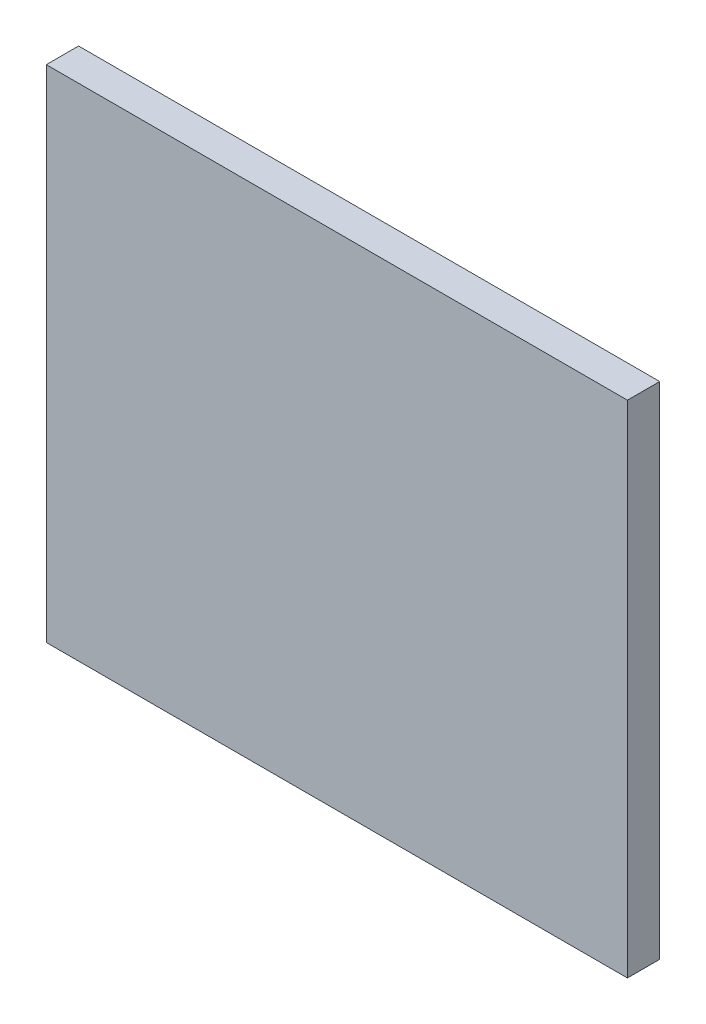
from build123d import *

# Parameters (mm, degrees)
SKETCH1_W     = 36
SKETCH1_H     = 31
PROFILE_DEPTH = 2


with BuildPart() as part:
    # Sketch1 → Profile (new body)
    with BuildSketch(Plane.XY):
        with Locations((18, 15.5)):
            Rectangle(SKETCH1_W, SKETCH1_H)
    extrude(amount=PROFILE_DEPTH)


solid = part.part
